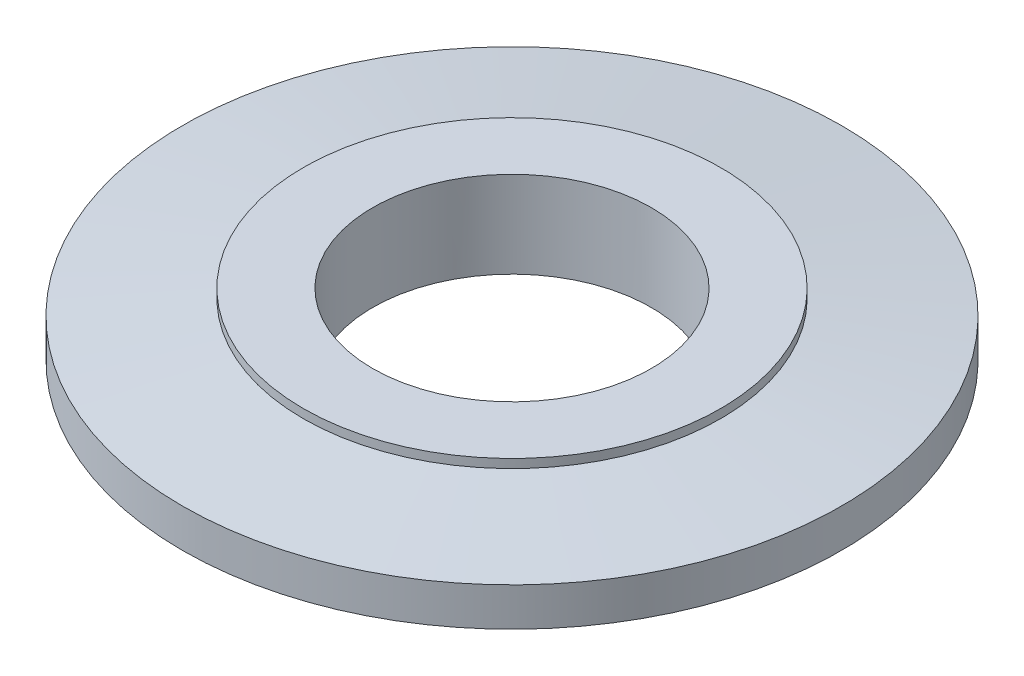
from build123d import *

# Parameters (mm, degrees)
CUT_EXTRUDE1_DEPTH      = 18.260431628
CUT_EXTRUDE1_DEPTH_BACK = 18.260431628
SKETCH5_R               = 5.075


with BuildPart() as part:
    # Sketch4 → Revolve1 (revolve)
    with BuildSketch(Plane.XY):
        Polygon((0, 1.575), (7.6, 1.575), (7.6, 1.255), (12, 0.7), (12, -0.7), (7.6, -1.255), (7.6, -1.575), (0, -1.575), align=None)
    revolve(axis=Axis((0, 11.116738423, 0), (0, -1, 0)))

    # Sketch5 → Cut-Extrude1 (cut, two sides: drawn at the far end of the back side and taken through both)
    with BuildSketch(Plane(origin=(0, 1.575, 0), x_dir=(1, 0, 0), z_dir=(0, 1, 0)).offset(-CUT_EXTRUDE1_DEPTH_BACK)):
        Circle(SKETCH5_R)
    extrude(amount=CUT_EXTRUDE1_DEPTH + CUT_EXTRUDE1_DEPTH_BACK, mode=Mode.SUBTRACT)


solid = part.part
